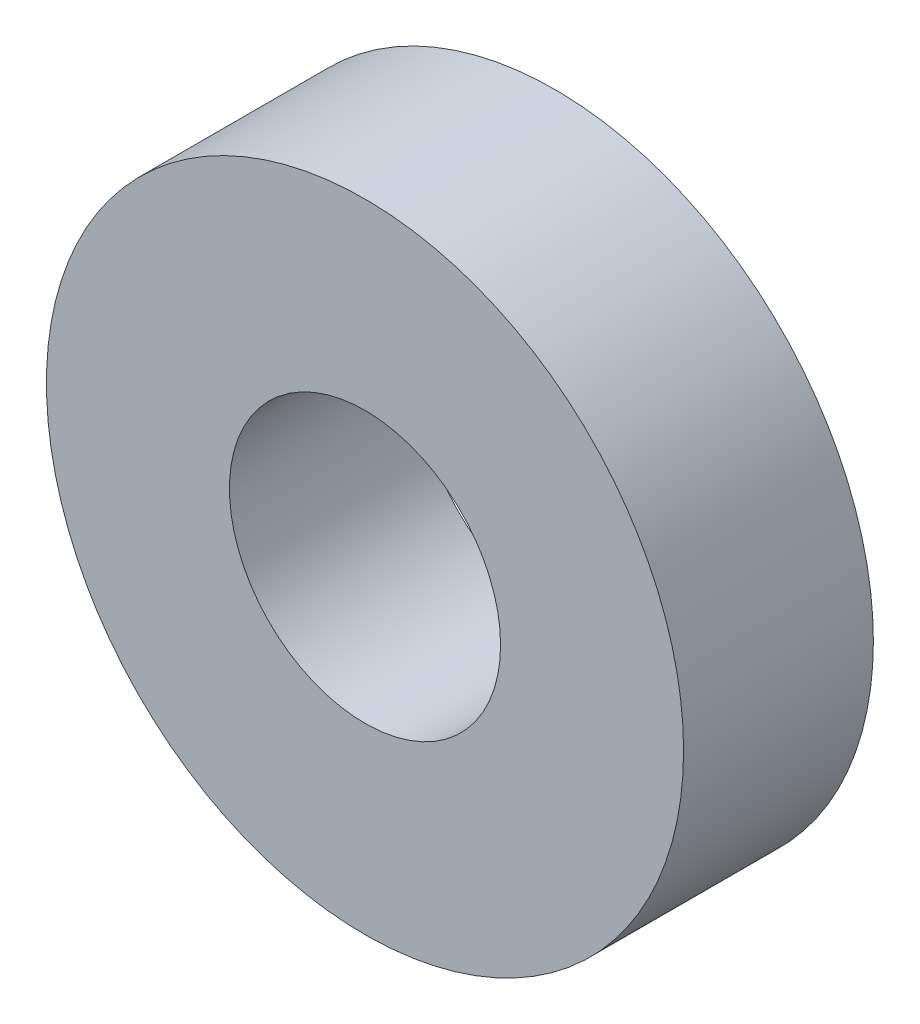
from build123d import *

# Parameters (mm, degrees)
PURCHASED_BEARING_ENVELOPE_START = 26
SKETCH_1_R                       = 23.5
SKETCH_1_R_2                     = 10
PURCHASED_BEARING_ENVELOPE_DEPTH = 14


with BuildPart() as part:
    # Эскиз1 → Purchased_bearing_envelope (new body)
    with BuildSketch(Plane.XY.offset(PURCHASED_BEARING_ENVELOPE_START)):
        Circle(SKETCH_1_R)
        Circle(SKETCH_1_R_2, mode=Mode.SUBTRACT)
    extrude(amount=PURCHASED_BEARING_ENVELOPE_DEPTH)


solid = part.part
